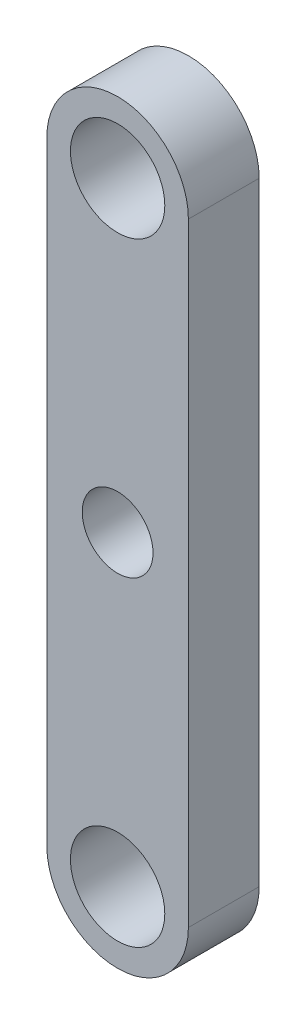
from build123d import *

# Parameters (mm, degrees)
SKETCH1_R           = 1.5
BOSS_EXTRUDE1_DEPTH = 3
SKETCH3_R           = 2
CUT_EXTRUDE2_DEPTH  = 10


with BuildPart() as part:
    # Sketch1 → Boss-Extrude1 (new body)
    with BuildSketch(Plane.XY):
        with BuildLine():
            Line((3, 13), (3, -13))
            ThreePointArc((3, -13), (0, -16), (-3, -13))
            Line((-3, -13), (-3, 13))
            ThreePointArc((-3, 13), (0, 16), (3, 13))
        make_face()
        with Locations((0, 13)):
            Circle(SKETCH1_R, mode=Mode.SUBTRACT)
        with Locations((0, -13)):
            Circle(SKETCH1_R, mode=Mode.SUBTRACT)
        Circle(SKETCH1_R, mode=Mode.SUBTRACT)
    extrude(amount=BOSS_EXTRUDE1_DEPTH)

    # Sketch3 → Cut-Extrude2 (cut)
    with BuildSketch(Plane.XY.offset(3)):
        with Locations((0, -13)):
            Circle(SKETCH3_R)
        with Locations((0, 13)):
            Circle(SKETCH3_R)
    extrude(amount=-CUT_EXTRUDE2_DEPTH, mode=Mode.SUBTRACT)


solid = part.part
